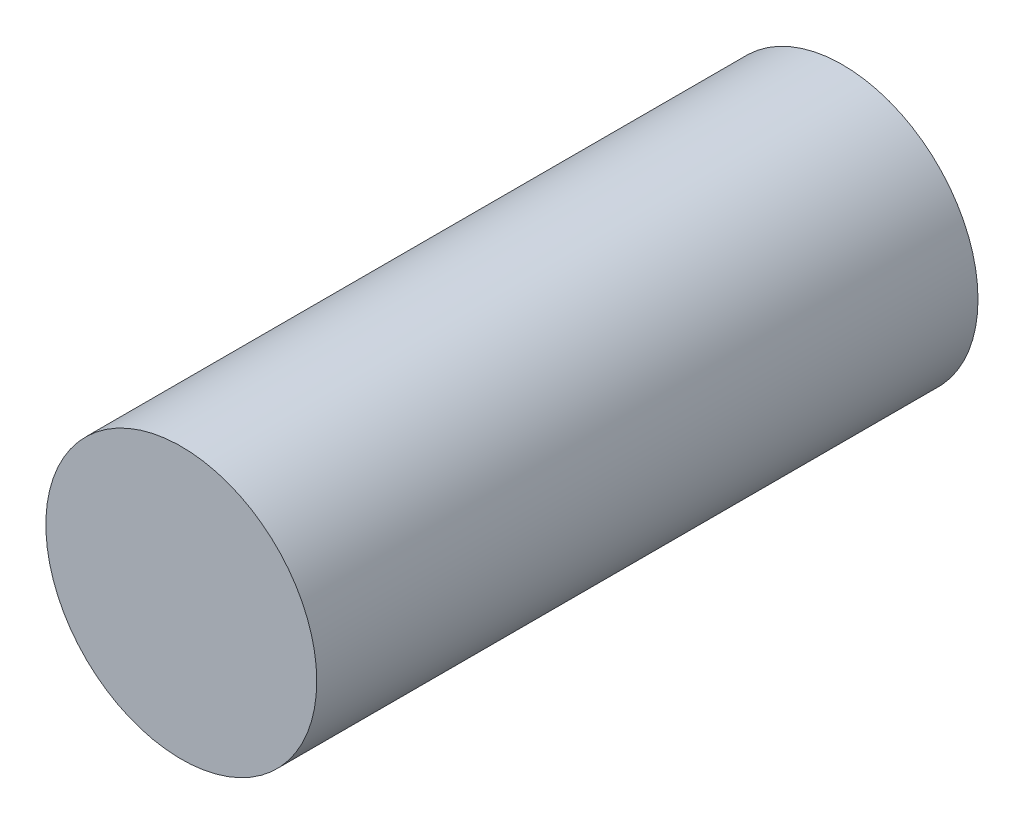
from build123d import *

# Parameters (mm, degrees)
SKETCH1_R           = 1209.806435551
BOSS_EXTRUDE1_DEPTH = 5906.114982768


with BuildPart() as part:
    # Sketch1 → Boss-Extrude1 (new body)
    with BuildSketch(Plane.XY):
        Circle(SKETCH1_R)
    extrude(amount=BOSS_EXTRUDE1_DEPTH)


solid = part.part
